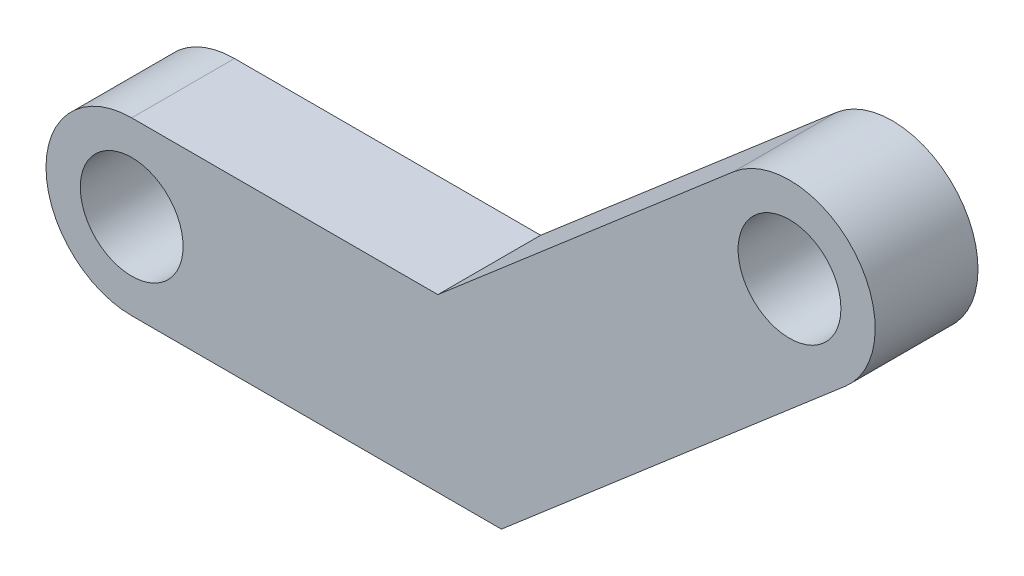
from build123d import *

# Parameters (mm, degrees)
SKETCH1_R           = 1.5
BOSS_EXTRUDE1_DEPTH = 3


with BuildPart() as part:
    # Sketch1 → Boss-Extrude1 (new body)
    with BuildSketch(Plane.XY):
        with BuildLine():
            Line((3.877739867, -2.5), (14.664750766, -2.5))
            Line((14.664750766, -2.5), (24.701689624, 6.130082034))
            ThreePointArc((24.701689624, 6.130082034), (24.967394781, 9.655617563), (21.441859251, 9.92132272))
            Line((21.441859251, 9.92132272), (12.810728968, 2.5))
            Line((12.810728968, 2.5), (3.877739867, 2.5))
            ThreePointArc((3.877739867, 2.5), (1.377739867, 0), (3.877739867, -2.5))
        make_face()
        with Locations((23.071774437, 8.025702377)):
            Circle(SKETCH1_R, mode=Mode.SUBTRACT)
        with Locations((3.877739867, 0)):
            Circle(SKETCH1_R, mode=Mode.SUBTRACT)
    extrude(amount=BOSS_EXTRUDE1_DEPTH)


solid = part.part
